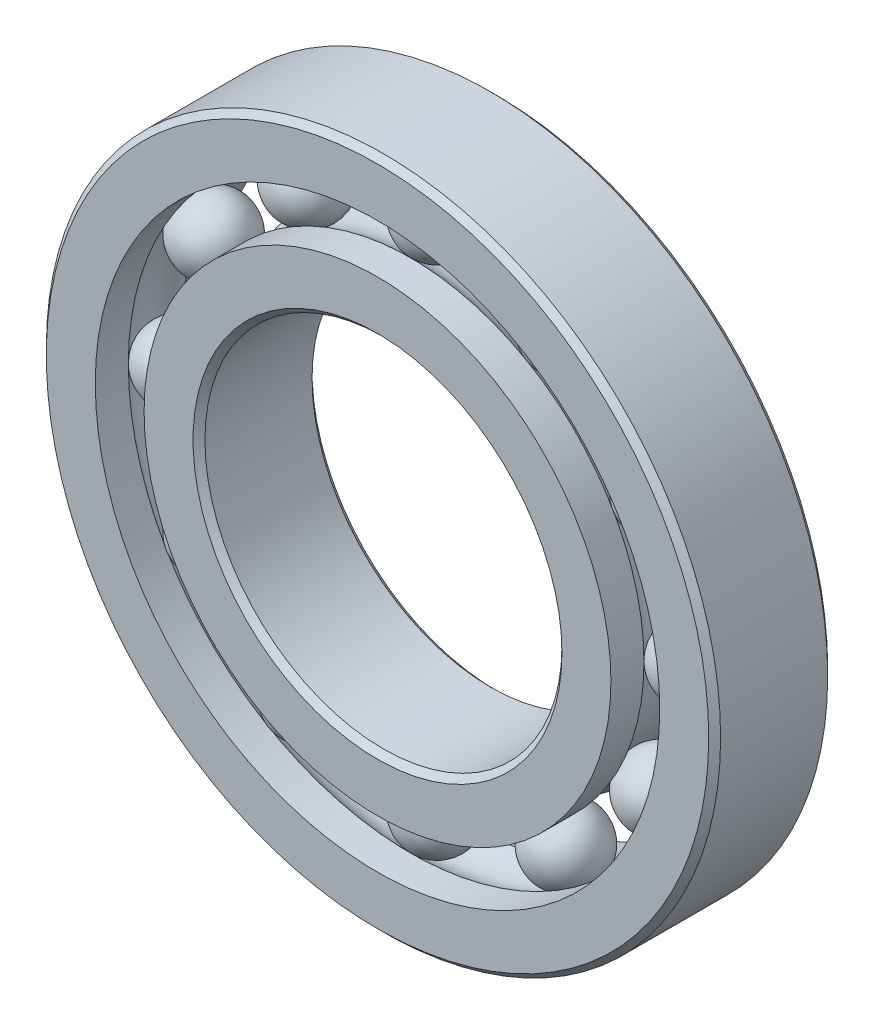
from build123d import *

# Parameters (mm, degrees)
CIRPATTERN1_COUNT = 12


with BuildPart() as part:
    # Sketch1 → Revolve1 (revolve)
    with BuildSketch(Plane(origin=(0, 0, 0), x_dir=(0, 0, -1), z_dir=(1, 0, 0))):
        with BuildLine():
            Line((4.28625, 26.9875), (-4.28625, 26.9875))
            Line((-4.28625, 26.9875), (-4.7625, 26.51125))
            Line((-4.7625, 26.51125), (-4.7625, 22.591346154))
            Line((-4.7625, 22.591346154), (-2.116666667, 22.591346154))
            ThreePointArc((-2.116666667, 22.591346154), (0, 23.518088928), (2.116666667, 22.591346154))
            Line((2.116666667, 22.591346154), (4.7625, 22.591346154))
            Line((4.7625, 22.591346154), (4.7625, 26.51125))
            Line((4.7625, 26.51125), (4.28625, 26.9875))
        make_face()
    revolve(axis=Axis((0, 0, 4.7625), (0, 0, -1)))


with BuildPart() as body_2:
    # Sketch3 → Revolve3 (revolve)
    with BuildSketch(Plane(origin=(0, 0, 0), x_dir=(0, 0, -1), z_dir=(1, 0, 0))):
        with BuildLine():
            Line((-4.7625, 18.683653846), (-2.116666667, 18.683653846))
            ThreePointArc((-2.116666667, 18.683653846), (0, 17.756911072), (2.116666667, 18.683653846))
            Line((2.116666667, 18.683653846), (4.7625, 18.683653846))
            Line((4.7625, 18.683653846), (4.7625, 14.76375))
            Line((4.7625, 14.76375), (4.28625, 14.2875))
            Line((4.28625, 14.2875), (-4.28625, 14.2875))
            Line((-4.28625, 14.2875), (-4.7625, 14.76375))
            Line((-4.7625, 14.76375), (-4.7625, 18.683653846))
        make_face()
    revolve(axis=Axis((0, 0, 4.7625), (0, 0, -1)))


with BuildPart() as body_3:
    # Sketch4 → Revolve4 (revolve)
    with BuildSketch(Plane(origin=(0, 0, 0), x_dir=(0, 0, -1), z_dir=(1, 0, 0))):
        with BuildLine():
            Line((-2.880588928, 20.6375), (2.880588928, 20.6375))
            ThreePointArc((2.880588928, 20.6375), (0, 23.518088928), (-2.880588928, 20.6375))
        make_face()
    revolve(axis=Axis((0, 20.6375, 2.880588928), (0, 0, -1)))


with BuildPart() as cirpattern1_1:
    # CirPattern1: pattern copy
    add(body_3.part.rotate(Axis((0, 0, -4.7625), (0, 0, 1)), 1 * 360 / CIRPATTERN1_COUNT))


with BuildPart() as cirpattern1_2:
    # CirPattern1: pattern copy
    add(body_3.part.rotate(Axis((0, 0, -4.7625), (0, 0, 1)), 2 * 360 / CIRPATTERN1_COUNT))


with BuildPart() as cirpattern1_3:
    # CirPattern1: pattern copy
    add(body_3.part.rotate(Axis((0, 0, -4.7625), (0, 0, 1)), 3 * 360 / CIRPATTERN1_COUNT))


with BuildPart() as cirpattern1_4:
    # CirPattern1: pattern copy
    add(body_3.part.rotate(Axis((0, 0, -4.7625), (0, 0, 1)), 4 * 360 / CIRPATTERN1_COUNT))


with BuildPart() as cirpattern1_5:
    # CirPattern1: pattern copy
    add(body_3.part.rotate(Axis((0, 0, -4.7625), (0, 0, 1)), 5 * 360 / CIRPATTERN1_COUNT))


with BuildPart() as cirpattern1_6:
    # CirPattern1: pattern copy
    add(body_3.part.rotate(Axis((0, 0, -4.7625), (0, 0, 1)), 6 * 360 / CIRPATTERN1_COUNT))


with BuildPart() as cirpattern1_7:
    # CirPattern1: pattern copy
    add(body_3.part.rotate(Axis((0, 0, -4.7625), (0, 0, 1)), 7 * 360 / CIRPATTERN1_COUNT))


with BuildPart() as cirpattern1_8:
    # CirPattern1: pattern copy
    add(body_3.part.rotate(Axis((0, 0, -4.7625), (0, 0, 1)), 8 * 360 / CIRPATTERN1_COUNT))


with BuildPart() as cirpattern1_9:
    # CirPattern1: pattern copy
    add(body_3.part.rotate(Axis((0, 0, -4.7625), (0, 0, 1)), 9 * 360 / CIRPATTERN1_COUNT))


with BuildPart() as cirpattern1_10:
    # CirPattern1: pattern copy
    add(body_3.part.rotate(Axis((0, 0, -4.7625), (0, 0, 1)), 10 * 360 / CIRPATTERN1_COUNT))


with BuildPart() as cirpattern1_11:
    # CirPattern1: pattern copy
    add(body_3.part.rotate(Axis((0, 0, -4.7625), (0, 0, 1)), 11 * 360 / CIRPATTERN1_COUNT))


solid = Compound([part.part, body_2.part, body_3.part, cirpattern1_1.part, cirpattern1_2.part, cirpattern1_3.part, cirpattern1_4.part, cirpattern1_5.part, cirpattern1_6.part, cirpattern1_7.part, cirpattern1_8.part, cirpattern1_9.part, cirpattern1_10.part, cirpattern1_11.part])
